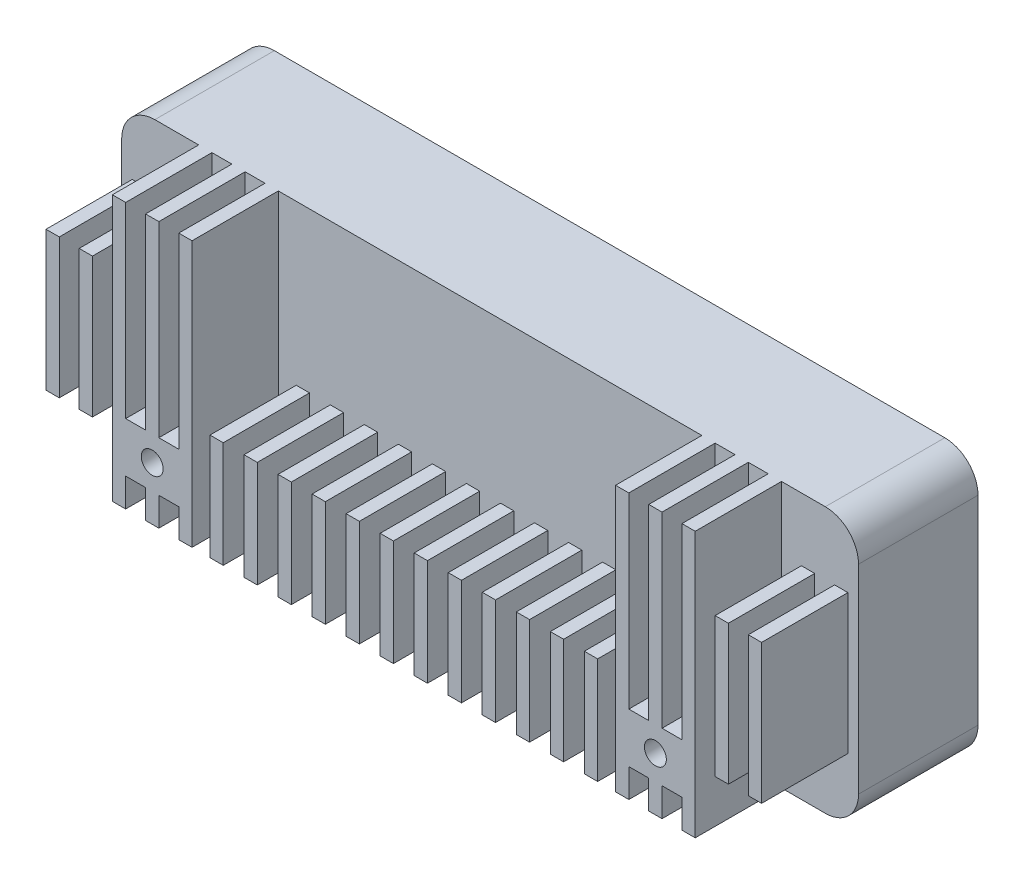
from build123d import *

# Parameters (mm, degrees)
ESBO_O1_W                = 111
ESBO_O1_H                = 40
RESSALTO_EXTRUS_O1_DEPTH = 18
ESBO_O2_W                = 2
ESBO_O2_H                = 16
ESBO_O2_H_2              = 21
ESBO_O2_H_3              = 40
RESSALTO_EXTRUS_O2_DEPTH = 13
RESSALTO_EXTRUS_O3_REACH = 68.643
ESBO_O3_W                = 3
ESBO_O3_H                = 7.5
ESBO_O4_R                = 1.65
CORTE_EXTRUS_O1_DEPTH    = 6
FILETE1_R                = 5


with BuildPart() as part:
    # Esboço1 → Ressalto-extrusão1 (new body)
    with BuildSketch(Plane.XY):
        Rectangle(ESBO_O1_W, ESBO_O1_H)
    extrude(amount=RESSALTO_EXTRUS_O1_DEPTH)

    # Esboço2 → Ressalto-extrusão2 (add)
    with BuildSketch(Plane.XY.offset(18)):
        with Locations((-28.2, -12)):
            Rectangle(ESBO_O2_W, ESBO_O2_H)
        with Locations((-23.072727273, -12)):
            Rectangle(ESBO_O2_W, ESBO_O2_H)
        with Locations((-17.945454545, -12)):
            Rectangle(ESBO_O2_W, ESBO_O2_H)
        with Locations((-12.818181818, -12)):
            Rectangle(ESBO_O2_W, ESBO_O2_H)
        with Locations((-7.690909091, -12)):
            Rectangle(ESBO_O2_W, ESBO_O2_H)
        with Locations((-2.563636364, -12)):
            Rectangle(ESBO_O2_W, ESBO_O2_H)
        with Locations((2.563636364, -12)):
            Rectangle(ESBO_O2_W, ESBO_O2_H)
        with Locations((7.690909091, -12)):
            Rectangle(ESBO_O2_W, ESBO_O2_H)
        with Locations((12.818181818, -12)):
            Rectangle(ESBO_O2_W, ESBO_O2_H)
        with Locations((17.945454545, -12)):
            Rectangle(ESBO_O2_W, ESBO_O2_H)
        with Locations((23.072727273, -12)):
            Rectangle(ESBO_O2_W, ESBO_O2_H)
        with Locations((28.2, -12)):
            Rectangle(ESBO_O2_W, ESBO_O2_H)
        with Locations((-47.9, 0)):
            Rectangle(ESBO_O2_W, ESBO_O2_H_2)
        with Locations((-52.9, 0)):
            Rectangle(ESBO_O2_W, ESBO_O2_H_2)
        with Locations((-42.9, 0)):
            Rectangle(ESBO_O2_W, ESBO_O2_H_3)
        with Locations((-37.9, 0)):
            Rectangle(ESBO_O2_W, ESBO_O2_H_3)
        with Locations((-32.9, 0)):
            Rectangle(ESBO_O2_W, ESBO_O2_H_3)
        with Locations((32.9, 0)):
            Rectangle(ESBO_O2_W, ESBO_O2_H_3)
        with Locations((37.9, 0)):
            Rectangle(ESBO_O2_W, ESBO_O2_H_3)
        with Locations((42.9, 0)):
            Rectangle(ESBO_O2_W, ESBO_O2_H_3)
        with Locations((47.9, 0)):
            Rectangle(ESBO_O2_W, ESBO_O2_H_2)
        with Locations((52.9, 0)):
            Rectangle(ESBO_O2_W, ESBO_O2_H_2)
    extrude(amount=RESSALTO_EXTRUS_O2_DEPTH)

    # Esboço3 → Ressalto-extrusão3 (add, up to next)
    with BuildSketch(Plane.XY.offset(31), mode=Mode.PRIVATE) as ressalto_extrus_o3_sk1:
        with Locations((-40.4, -11.95)):
            Rectangle(ESBO_O3_W, ESBO_O3_H)
    ressalto_extrus_o3_tool1 = extrude(ressalto_extrus_o3_sk1.sketch, amount=-RESSALTO_EXTRUS_O3_REACH, mode=Mode.PRIVATE) - part.part
    # Esboço3 → Ressalto-extrusão3 (add, up to next)
    with BuildSketch(Plane.XY.offset(31), mode=Mode.PRIVATE) as ressalto_extrus_o3_sk2:
        with Locations((-35.4, -11.95)):
            Rectangle(ESBO_O3_W, ESBO_O3_H)
    ressalto_extrus_o3_tool2 = extrude(ressalto_extrus_o3_sk2.sketch, amount=-RESSALTO_EXTRUS_O3_REACH, mode=Mode.PRIVATE) - part.part
    # Esboço3 → Ressalto-extrusão3 (add, up to next)
    with BuildSketch(Plane.XY.offset(31), mode=Mode.PRIVATE) as ressalto_extrus_o3_sk3:
        with Locations((35.4, -11.95)):
            Rectangle(ESBO_O3_W, ESBO_O3_H)
    ressalto_extrus_o3_tool3 = extrude(ressalto_extrus_o3_sk3.sketch, amount=-RESSALTO_EXTRUS_O3_REACH, mode=Mode.PRIVATE) - part.part
    # Esboço3 → Ressalto-extrusão3 (add, up to next)
    with BuildSketch(Plane.XY.offset(31), mode=Mode.PRIVATE) as ressalto_extrus_o3_sk4:
        with Locations((40.4, -11.95)):
            Rectangle(ESBO_O3_W, ESBO_O3_H)
    ressalto_extrus_o3_tool4 = extrude(ressalto_extrus_o3_sk4.sketch, amount=-RESSALTO_EXTRUS_O3_REACH, mode=Mode.PRIVATE) - part.part
    add(ressalto_extrus_o3_tool1.solids().sort_by_distance((-40.4, -11.95, 31))[0])
    add(ressalto_extrus_o3_tool2.solids().sort_by_distance((-35.4, -11.95, 31))[0])
    add(ressalto_extrus_o3_tool3.solids().sort_by_distance((35.4, -11.95, 31))[0])
    add(ressalto_extrus_o3_tool4.solids().sort_by_distance((40.4, -11.95, 31))[0])

    # Esboço4 → Corte-extrusão1 (cut)
    with BuildSketch(Plane.XY.offset(31)):
        with Locations((-37.9, -11.95)):
            Circle(ESBO_O4_R)
        with Locations(Location((37.9, -11.95, 0), (0, 0, 180))):
            Circle(ESBO_O4_R)
    extrude(amount=-CORTE_EXTRUS_O1_DEPTH, mode=Mode.SUBTRACT)

    # Filete1
    filete1_edges = [part.edges().sort_by_distance(p)[0] for p in [
        (-55.5, 20, 9),
        (55.5, 20, 9),
        (55.5, -20, 9),
        (-55.5, -20, 9),
    ]]
    fillet(filete1_edges, radius=FILETE1_R)


solid = part.part
